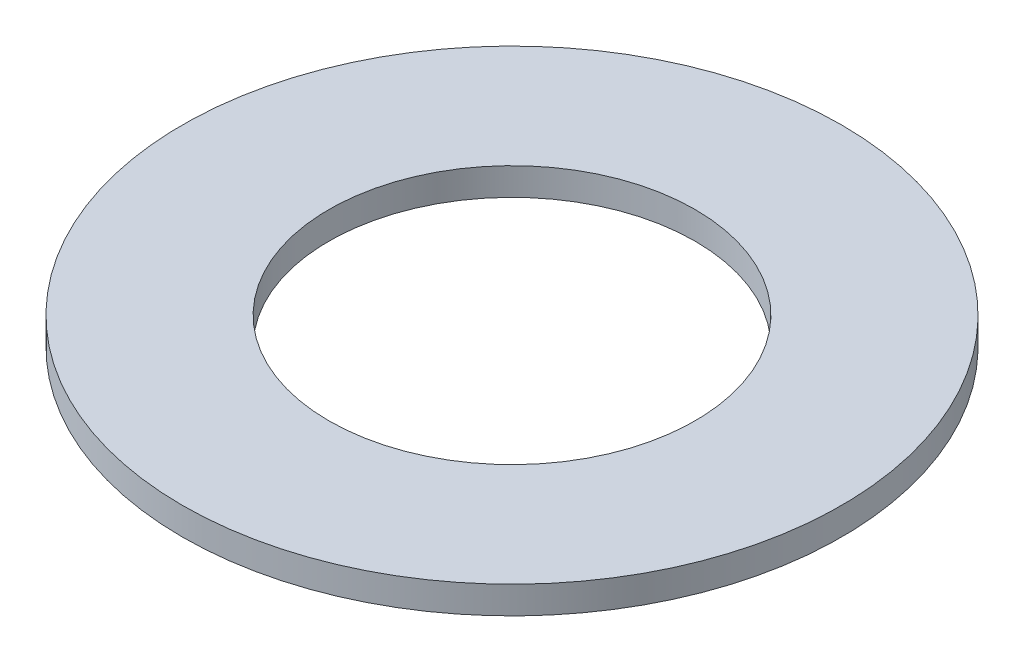
from build123d import *

# Parameters (mm, degrees)
SKETCH1_R           = 36
SKETCH1_R_2         = 20
BOSS_EXTRUDE1_DEPTH = 3


with BuildPart() as part:
    # Sketch1 → Boss-Extrude1 (new body)
    with BuildSketch(Plane(origin=(0, 0, 0), x_dir=(1, 0, 0), z_dir=(0, 1, 0))):
        with Locations(Location((0, 0, 0), (0, 0, 270))):
            Circle(SKETCH1_R)
        with Locations(Location((0, 0, 0), (0, 0, 270))):
            Circle(SKETCH1_R_2, mode=Mode.SUBTRACT)
    extrude(amount=BOSS_EXTRUDE1_DEPTH)


solid = part.part
